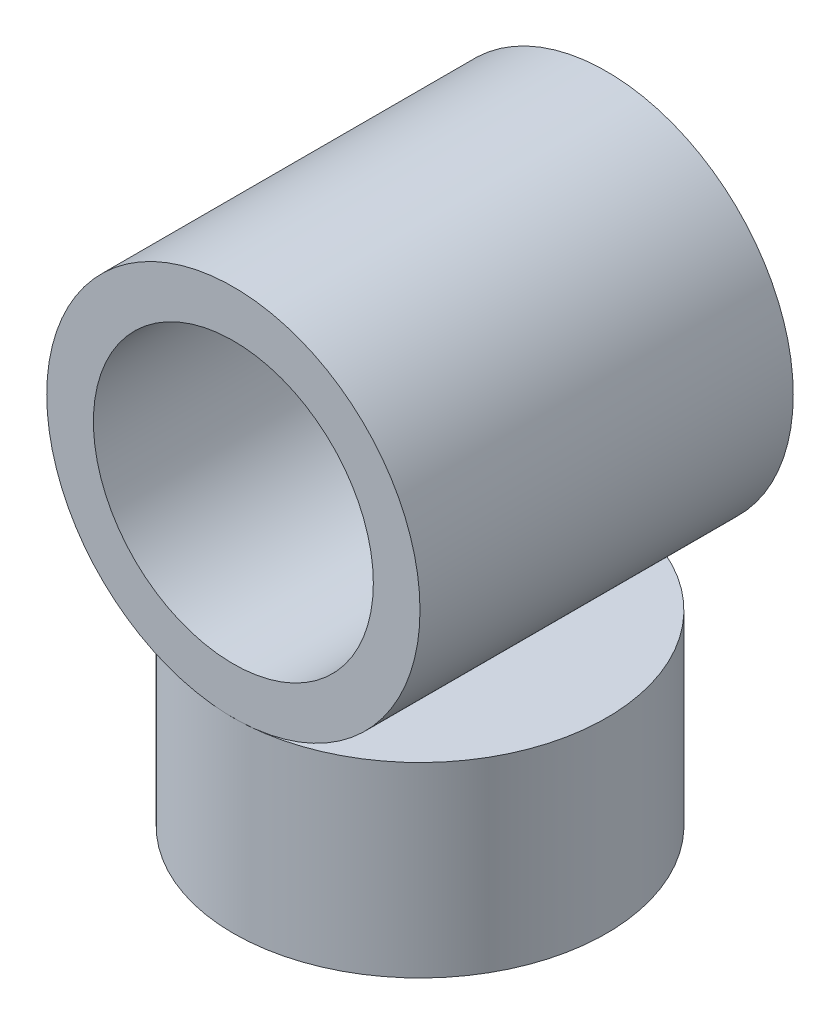
from build123d import *

# Parameters (mm, degrees)
SKETCH2_R           = 10
BOSS_EXTRUDE2_DEPTH = 10
SKETCH3_R           = 7.5
CUT_EXTRUDE1_DEPTH  = 5
SKETCH5_R           = 10
BOSS_EXTRUDE3_DEPTH = 10
SKETCH6_R           = 7.5
CUT_EXTRUDE2_DEPTH  = 20


with BuildPart() as part:
    # Sketch2 → Boss-Extrude2 (new body)
    with BuildSketch(Plane(origin=(0, 0, 0), x_dir=(1, 0, 0), z_dir=(0, 1, 0))):
        with Locations(Location((0, 0, 0), (0, 0, 270))):
            Circle(SKETCH2_R)
    extrude(amount=-BOSS_EXTRUDE2_DEPTH)

    # Sketch3 → Cut-Extrude1 (cut)
    with BuildSketch(Plane(origin=(0, -10, 0), x_dir=(-1, 0, 0), z_dir=(0, -1, 0))):
        with Locations(Location((0, 0, 0), (0, 0, 90))):
            Circle(SKETCH3_R)
    extrude(amount=-CUT_EXTRUDE1_DEPTH, mode=Mode.SUBTRACT)


with BuildPart() as body_2:
    # Sketch5 → Boss-Extrude3 (new, symmetric)
    with BuildSketch(Plane.XY):
        with Locations((0, 10)):
            Circle(SKETCH5_R)
    extrude(amount=BOSS_EXTRUDE3_DEPTH, both=True)

    # Sketch6 → Cut-Extrude2 (cut)
    with BuildSketch(Plane.XY.offset(10)):
        with Locations((0, 10)):
            Circle(SKETCH6_R)
    extrude(amount=-CUT_EXTRUDE2_DEPTH, mode=Mode.SUBTRACT)


solid = Compound([part.part, body_2.part])
